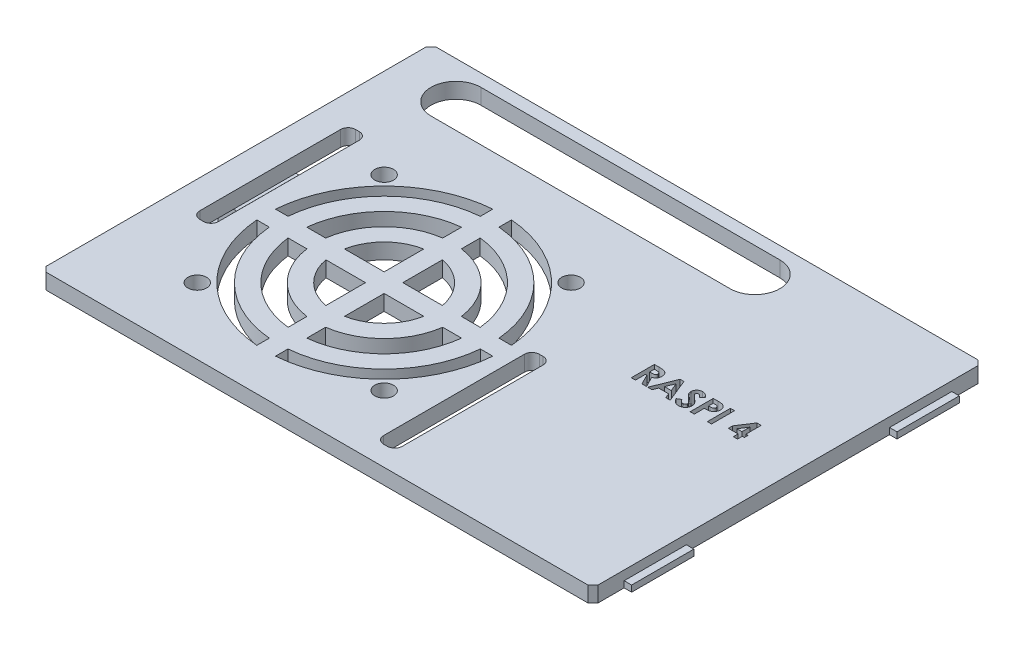
from build123d import *

# Parameters (mm, degrees)
BOSS_EXTRUDE1_DEPTH = 2.5
CUT_EXTRUDE1_DEPTH  = 2.5
SKETCH4_W           = 10
SKETCH4_H           = 1
BOSS_EXTRUDE2_DEPTH = 1.2
SKETCH6_W           = 1.5
SKETCH6_H           = 10
BOSS_EXTRUDE3_DEPTH = 5
SKETCH7_W           = 10
SKETCH7_H           = 1.2
BOSS_EXTRUDE4_DEPTH = 1.5
CHAMFER1_SIZE       = 1.5
CHAMFER2_SIZE       = 0.5
CHAMFER3_SIZE       = 0.2
CUT_EXTRUDE2_DEPTH  = 3
SKETCH10_R          = 1.5
CUT_EXTRUDE3_DEPTH  = 3
SKETCH11_W          = 0.664850428
SKETCH11_H          = 3.704166667
CUT_EXTRUDE4_DEPTH  = 2


with BuildPart() as part:
    # Sketch1 → Boss-Extrude1 (new body)
    with BuildSketch(Plane(origin=(0, 0, 0), x_dir=(1, 0, 0), z_dir=(0, 1, 0))):
        Polygon((44.69064293, 30.208190172), (43.776429368, 31.122403734), (-43.395143508, 31.122403734), (-44.30935707, 30.208190172), (-44.30935707, -30.963382704), (-43.395143508, -31.877596266), (43.776429368, -31.877596266), (44.69064293, -30.963382704), align=None)
    extrude(amount=BOSS_EXTRUDE1_DEPTH)

    # Sketch2 → Cut-Extrude1 (cut)
    with BuildSketch(Plane(origin=(0, 2.5, 0), x_dir=(1, 0, 0), z_dir=(0, 1, 0))):
        Polygon((44.69064293, -30.963382704), (44.69064293, 30.208190172), (43.776429368, 31.122403734), (-43.395143508, 31.122403734), (-44.30935707, 30.208190172), (-44.30935707, -30.963382704), (-43.395143508, -31.877596266), (43.776429368, -31.877596266), align=None)
        Polygon((43.693586655, 30.922403734), (-43.312300795, 30.922403734), (-44.10935707, 30.125347459), (-44.10935707, -30.880539991), (-43.312300795, -31.677596266), (43.693586655, -31.677596266), (44.49064293, -30.880539991), (44.49064293, 30.125347459), align=None, mode=Mode.SUBTRACT)
    extrude(amount=-CUT_EXTRUDE1_DEPTH, mode=Mode.SUBTRACT)

    # Sketch4 → Boss-Extrude2 (add)
    with BuildSketch(Plane(origin=(44.49064293, 0, 0), x_dir=(0, 0, -1), z_dir=(1, 0, 0))):
        with Locations((20.922403734, 0.5)):
            Rectangle(SKETCH4_W, SKETCH4_H)
        with Locations((-21.677596266, 0.5)):
            Rectangle(SKETCH4_W, SKETCH4_H)
    extrude(amount=BOSS_EXTRUDE2_DEPTH)

    # Sketch6 → Boss-Extrude3 (add)
    with BuildSketch(Plane.XZ):
        with Locations((-41.25935707, 0.377596266)):
            Rectangle(SKETCH6_W, SKETCH6_H)
    extrude(amount=BOSS_EXTRUDE3_DEPTH)

    # Sketch7 → Boss-Extrude4 (add)
    with BuildSketch(Plane.ZY.offset(42.00935707)):
        with Locations((0.377596266, -4.4)):
            Rectangle(SKETCH7_W, SKETCH7_H)
    extrude(amount=BOSS_EXTRUDE4_DEPTH)

    # Chamfer1
    chamfer1_edges = [part.edges().sort_by_distance(p)[0] for p in [
        (-40.50935707, 0, 0.377596266),
    ]]
    chamfer(chamfer1_edges, length=CHAMFER1_SIZE)

    # Chamfer2
    chamfer2_edges = [part.edges().sort_by_distance(p)[0] for p in [
        (-42.00935707, -3.8, 0.377596266),
    ]]
    chamfer(chamfer2_edges, length=CHAMFER2_SIZE)

    # Chamfer3
    chamfer3_edges = [part.edges().sort_by_distance(p)[0] for p in [
        (-43.50935707, -5, 0.377596266),
        (-43.50935707, -3.8, 0.377596266),
    ]]
    chamfer(chamfer3_edges, length=CHAMFER3_SIZE)

    # Sketch9 → Cut-Extrude2 (cut)
    with BuildSketch(Plane.XZ):
        with BuildLine():
            Line((7.7, 3.5), (8.3, 3.5))
            ThreePointArc((8.3, 3.5), (9.148528137, 3.851471863), (9.5, 4.7))
            Line((9.5, 4.7), (9.5, 27.3))
            ThreePointArc((9.5, 27.3), (9.148528137, 28.148528137), (8.3, 28.5))
            Line((8.3, 28.5), (7.7, 28.5))
            ThreePointArc((7.7, 28.5), (6.851471863, 28.148528137), (6.5, 27.3))
            Line((6.5, 27.3), (6.5, 4.7))
            ThreePointArc((6.5, 4.7), (6.851471863, 3.851471863), (7.7, 3.5))
        make_face()
        with BuildLine():
            Line((-38.3, 12), (-37.7, 12))
            ThreePointArc((-37.7, 12), (-36.851471863, 11.648528137), (-36.5, 10.8))
            Line((-36.5, 10.8), (-36.5, -11.8))
            ThreePointArc((-36.5, -11.8), (-36.851471863, -12.648528137), (-37.7, -13))
            Line((-37.7, -13), (-38.3, -13))
            ThreePointArc((-38.3, -13), (-39.148528137, -12.648528137), (-39.5, -11.8))
            Line((-39.5, -11.8), (-39.5, 10.8))
            ThreePointArc((-39.5, 10.8), (-39.148528137, 11.648528137), (-38.3, 12))
        make_face()
        with BuildLine():
            Line((-34.10935707, -20.922403734), (13.89064293, -20.922403734))
            ThreePointArc((13.89064293, -20.922403734), (17.89064293, -24.922403734), (13.89064293, -28.922403734))
            Line((13.89064293, -28.922403734), (-34.10935707, -28.922403734))
            ThreePointArc((-34.10935707, -28.922403734), (-38.10935707, -24.922403734), (-34.10935707, -20.922403734))
        make_face()
    extrude(amount=-CUT_EXTRUDE2_DEPTH, mode=Mode.SUBTRACT)

    # Sketch10 → Cut-Extrude3 (cut)
    with BuildSketch(Plane(origin=(0, 2.5, 0), x_dir=(1, 0, 0), z_dir=(0, 1, 0))):
        with BuildLine():
            ThreePointArc((-6.851240247, -4.5), (-9.052502821, -0.343145751), (-13.20935707, 1.858116823))
            Line((-13.20935707, 1.858116823), (-13.20935707, -4.5))
            Line((-13.20935707, -4.5), (-6.851240247, -4.5))
        make_face()
        with BuildLine():
            Line((-6.851240247, -7.5), (-13.20935707, -7.5))
            Line((-13.20935707, -7.5), (-13.20935707, -13.858116823))
            ThreePointArc((-13.20935707, -13.858116823), (-9.052502821, -11.656854249), (-6.851240247, -7.5))
        make_face()
        with BuildLine():
            Line((-16.20935707, -13.858116823), (-16.20935707, -7.5))
            Line((-16.20935707, -7.5), (-22.567473893, -7.5))
            ThreePointArc((-22.567473893, -7.5), (-20.36621132, -11.656854249), (-16.20935707, -13.858116823))
        make_face()
        with BuildLine():
            Line((-16.20935707, -4.5), (-16.20935707, 1.858116823))
            ThreePointArc((-16.20935707, 1.858116823), (-20.36621132, -0.343145751), (-22.567473893, -4.5))
            Line((-22.567473893, -4.5), (-16.20935707, -4.5))
        make_face()
        with BuildLine():
            Line((-16.20935707, 4.897247359), (-16.20935707, 7.919410907))
            ThreePointArc((-16.20935707, 7.919410907), (-24.608852007, 3.899494937), (-28.628767977, -4.5))
            Line((-28.628767977, -4.5), (-25.606604429, -4.5))
            ThreePointArc((-25.606604429, -4.5), (-22.487531663, 1.778174593), (-16.20935707, 4.897247359))
        make_face()
        with BuildLine():
            ThreePointArc((-0.789946163, -4.5), (-4.809862133, 3.899494937), (-13.20935707, 7.919410907))
            Line((-13.20935707, 7.919410907), (-13.20935707, 4.897247359))
            ThreePointArc((-13.20935707, 4.897247359), (-6.931182477, 1.778174593), (-3.812109711, -4.5))
            Line((-3.812109711, -4.5), (-0.789946163, -4.5))
        make_face()
        with BuildLine():
            ThreePointArc((-13.20935707, -19.919410907), (-4.809862133, -15.899494937), (-0.789946163, -7.5))
            Line((-0.789946163, -7.5), (-3.812109711, -7.5))
            ThreePointArc((-3.812109711, -7.5), (-6.931182477, -13.778174593), (-13.20935707, -16.897247359))
            Line((-13.20935707, -16.897247359), (-13.20935707, -19.919410907))
        make_face()
        with BuildLine():
            Line((-25.606604429, -7.5), (-28.628767977, -7.5))
            ThreePointArc((-28.628767977, -7.5), (-24.608852007, -15.899494937), (-16.20935707, -19.919410907))
            Line((-16.20935707, -19.919410907), (-16.20935707, -16.897247359))
            ThreePointArc((-16.20935707, -16.897247359), (-22.487531663, -13.778174593), (-25.606604429, -7.5))
        make_face()
        with BuildLine():
            Line((-31.643051292, -7.5), (-33.650053995, -7.5))
            ThreePointArc((-33.650053995, -7.5), (-28.144385913, -19.435028843), (-16.20935707, -24.940696925))
            Line((-16.20935707, -24.940696925), (-16.20935707, -22.933694222))
            ThreePointArc((-16.20935707, -22.933694222), (-26.73017235, -18.02081528), (-31.643051292, -7.5))
        make_face()
        with BuildLine():
            Line((-16.20935707, 10.933694222), (-16.20935707, 12.940696925))
            ThreePointArc((-16.20935707, 12.940696925), (-28.144385913, 7.435028843), (-33.650053995, -4.5))
            Line((-33.650053995, -4.5), (-31.643051292, -4.5))
            ThreePointArc((-31.643051292, -4.5), (-26.73017235, 6.02081528), (-16.20935707, 10.933694222))
        make_face()
        with BuildLine():
            ThreePointArc((4.231339855, -4.5), (-1.274328228, 7.435028843), (-13.20935707, 12.940696925))
            Line((-13.20935707, 12.940696925), (-13.20935707, 10.933694222))
            ThreePointArc((-13.20935707, 10.933694222), (-2.68854179, 6.02081528), (2.224337152, -4.5))
            Line((2.224337152, -4.5), (4.231339855, -4.5))
        make_face()
        with BuildLine():
            ThreePointArc((-13.20935707, -24.940696925), (-1.274328228, -19.435028843), (4.231339855, -7.5))
            Line((4.231339855, -7.5), (2.224337152, -7.5))
            ThreePointArc((2.224337152, -7.5), (-2.68854179, -18.02081528), (-13.20935707, -22.933694222))
            Line((-13.20935707, -22.933694222), (-13.20935707, -24.940696925))
        make_face()
        with Locations(Location((-29.70935707, -21, 0), (0, 0, 270))):
            Circle(SKETCH10_R)
        with Locations(Location((0.29064293, -21, 0), (0, 0, 270))):
            Circle(SKETCH10_R)
        with Locations(Location((-29.70935707, 9, 0), (0, 0, 270))):
            Circle(SKETCH10_R)
        with Locations(Location((0.29064293, 9, 0), (0, 0, 270))):
            Circle(SKETCH10_R)
    extrude(amount=-CUT_EXTRUDE3_DEPTH, mode=Mode.SUBTRACT)

    # Sketch11 → Cut-Extrude4 (cut)
    # profile 1 of 6: a face of its own
    with BuildSketch(Plane(origin=(0, 2.5, 0), x_dir=(1, 0, 0), z_dir=(0, 1, 0))):
        with BuildLine():
            Line((18.345718286, 4.320163812), (19.120387757, 4.320163812))
            add(Edge.make_bspline(
                [(19.120387757, 4.320163812), (19.171593173, 4.319982062), (19.270075612, 4.319632506), (19.412081911, 4.314117436), (19.542534225, 4.306442764), (19.661625701, 4.29473101), (19.76930539, 4.27920264), (19.865681213, 4.260897261), (19.950750351, 4.240034358), (20.025230246, 4.214037534), (20.092444669, 4.184713511), (20.155097855, 4.15101967), (20.214572028, 4.113331205), (20.270469666, 4.070656428), (20.323276534, 4.023763048), (20.373092254, 3.972603864), (20.419212885, 3.916745065), (20.461352845, 3.856539609), (20.499760027, 3.79320485), (20.53370392, 3.726653829), (20.561307151, 3.656840264), (20.585697564, 3.584773112), (20.603265188, 3.509422158), (20.615483214, 3.431520958), (20.624428775, 3.350795291), (20.624943102, 3.295953857), (20.625205465, 3.267978649)],
                knots=[0, 0, 0, 0, 1.749336639, 3.364467119, 4.854658419, 6.213483162, 7.451590619, 8.570285859, 9.5643256, 10.440900261, 11.26203566, 12.067320669, 12.869050712, 13.665104639, 14.467235401, 15.27997916, 16.102287765, 16.939272006, 17.78853747, 18.631303466, 19.488103222, 20.351255419, 21.228522269, 22.127379805, 23.044756219, 24, 24, 24, 24], degree=3))
            add(Edge.make_bspline(
                [(20.625205465, 3.267978649), (20.624523939, 3.238778959), (20.623187589, 3.181523688), (20.615989284, 3.097420365), (20.602833042, 3.016956188), (20.582906001, 2.940366747), (20.560002455, 2.866698796), (20.529546614, 2.797311556), (20.495174188, 2.731195889), (20.454351061, 2.669287027), (20.409549673, 2.61020985), (20.357446602, 2.556227824), (20.301417326, 2.50443962), (20.238312236, 2.458089075), (20.170913061, 2.414042132), (20.097880652, 2.374123871), (20.019691644, 2.33733084), (19.964720899, 2.316812505), (19.93661038, 2.306319995)],
                knots=[0, 0, 0, 0, 1.099860209, 2.156625411, 3.176576793, 4.16617041, 5.135385252, 6.078461593, 7.016046972, 7.938469504, 8.868247731, 9.803980173, 10.76021508, 11.73834243, 12.748633912, 13.790971185, 14.870363756, 16, 16, 16, 16], degree=3))
            Line((19.93661038, 2.306319995), (20.791418072, 0.615997145))
            Line((20.791418072, 0.615997145), (20.052365588, 0.615997145))
            Line((20.052365588, 0.615997145), (19.236142965, 2.230633898))
            Line((19.236142965, 2.230633898), (19.010568713, 2.230633898))
            Line((19.010568713, 2.230633898), (19.010568713, 0.615997145))
            Line((19.010568713, 0.615997145), (18.345718286, 0.615997145))
            Line((18.345718286, 0.615997145), (18.345718286, 4.320163812))
        make_face()
        with BuildLine():
            Line((19.010568713, 2.895484325), (19.269533891, 2.895484325))
            add(Edge.make_bspline(
                [(19.269533891, 2.895484325), (19.301194536, 2.895840908), (19.36181787, 2.896523689), (19.449002185, 2.899690709), (19.528186336, 2.907321662), (19.599710366, 2.916963087), (19.663934177, 2.928095503), (19.720284915, 2.944048932), (19.76963086, 2.961143436), (19.81138726, 2.982387469), (19.847062969, 3.006546542), (19.877866659, 3.033991849), (19.903345729, 3.065756298), (19.924316302, 3.100976668), (19.940629128, 3.139964473), (19.952536242, 3.182291717), (19.959190557, 3.228440561), (19.959956159, 3.260289547), (19.960355038, 3.276882896)],
                knots=[0, 0, 0, 0, 1.688639943, 3.233382647, 4.650958383, 5.928841754, 7.082724185, 8.122798841, 9.049171256, 9.863274652, 10.613301712, 11.341792392, 12.054588806, 12.776240173, 13.521029143, 14.301969904, 15.115324896, 16, 16, 16, 16], degree=3))
            add(Edge.make_bspline(
                [(19.960355038, 3.276882896), (19.95960092, 3.296514039), (19.958119596, 3.33507578), (19.943420259, 3.390591167), (19.92002209, 3.441974456), (19.887949608, 3.488993484), (19.847558487, 3.53021361), (19.801206488, 3.56654948), (19.747893225, 3.595281166), (19.698529155, 3.614232281), (19.653619389, 3.625570928), (19.613089743, 3.634020388), (19.566156168, 3.640008763), (19.512783233, 3.6463605), (19.453106987, 3.65047928), (19.386802159, 3.653485168), (19.314059176, 3.654715025), (19.263350408, 3.655108189), (19.236884986, 3.655313385)],
                knots=[0, 0, 0, 0, 1.020303359, 2.004196876, 2.966617323, 3.9489082, 4.950758222, 5.960522915, 7.003732012, 8.091992268, 8.70421221, 9.413913587, 10.24622431, 11.166358409, 12.212345909, 13.359657661, 14.621978493, 16, 16, 16, 16], degree=3))
            Line((19.236884986, 3.655313385), (19.010568713, 3.655313385))
            Line((19.010568713, 3.655313385), (19.010568713, 2.895484325))
        make_face(mode=Mode.SUBTRACT)
    # profile 2 of 6: a face of its own
    with BuildSketch(Plane(origin=(0, 2.5, 0), x_dir=(1, 0, 0), z_dir=(0, 1, 0))):
        Polygon((22.476546778, 4.320163812), (23.09464991, 4.320163812), (24.590563371, 0.615997145), (23.880449689, 0.615997145), (23.59254571, 1.375826205), (21.980135019, 1.375826205), (21.691489019, 0.615997145), (20.981375337, 0.615997145), align=None)
        Polygon((22.785969354, 3.326598274), (22.232422012, 2.040676633), (23.340258717, 2.040676633), align=None, mode=Mode.SUBTRACT)
    # profile 3 of 6: a face of its own
    with BuildSketch(Plane(origin=(0, 2.5, 0), x_dir=(1, 0, 0), z_dir=(0, 1, 0))):
        with BuildLine():
            Line((27.036263158, 3.825236094), (26.539109378, 3.370377487))
            add(Edge.make_bspline(
                [(26.539109378, 3.370377487), (26.517813442, 3.400417619), (26.476928214, 3.458090483), (26.410657525, 3.535315807), (26.344686082, 3.601194756), (26.278402699, 3.655452117), (26.211219867, 3.697758237), (26.143254204, 3.727711437), (26.074891027, 3.746752971), (26.028961526, 3.7491241), (26.006338612, 3.750292017)],
                knots=[0, 0, 0, 0, 1.299362458, 2.494594718, 3.587462134, 4.587049575, 5.512617175, 6.380583204, 7.202344345, 8, 8, 8, 8], degree=3))
            add(Edge.make_bspline(
                [(26.006338612, 3.750292017), (25.985236606, 3.749551971), (25.944494178, 3.748123137), (25.886412825, 3.733920633), (25.834847372, 3.709409197), (25.789848145, 3.677358432), (25.754202119, 3.63874469), (25.725741531, 3.598248804), (25.709715828, 3.553550504), (25.70760653, 3.522849908), (25.706562303, 3.507651292)],
                knots=[0, 0, 0, 0, 1.185010067, 2.2879431, 3.333075148, 4.379039566, 5.372662701, 6.27520591, 7.14612461, 8, 8, 8, 8], degree=3))
            add(Edge.make_bspline(
                [(25.706562303, 3.507651292), (25.707216667, 3.492233505), (25.708534466, 3.461184225), (25.721262612, 3.415677638), (25.740447561, 3.371212406), (25.758779563, 3.344144303), (25.76815001, 3.330308377)],
                knots=[0, 0, 0, 0, 0.967525499, 1.948461899, 2.951351359, 4, 4, 4, 4], degree=3))
            add(Edge.make_bspline(
                [(25.76815001, 3.330308377), (25.77666876, 3.319553856), (25.796277797, 3.29479837), (25.833668216, 3.255589539), (25.880622729, 3.20755529), (25.938948244, 3.152347378), (26.006223511, 3.087980312), (26.085566823, 3.016984386), (26.174694334, 2.937160938), (26.238044104, 2.881574779), (26.271239954, 2.852447132)],
                knots=[0, 0, 0, 0, 0.473873513, 1.090794244, 1.870441696, 2.795289791, 3.865433203, 5.087734844, 6.473946851, 8, 8, 8, 8], degree=3))
            add(Edge.make_bspline(
                [(26.271239954, 2.852447132), (26.302399034, 2.82548052), (26.361532494, 2.774303493), (26.445667666, 2.701665919), (26.519608469, 2.636315666), (26.584432052, 2.579233499), (26.639155754, 2.529820498), (26.684009633, 2.487840467), (26.719541502, 2.454110681), (26.739739289, 2.43373787), (26.748359178, 2.425043286)],
                knots=[0, 0, 0, 0, 1.543621617, 2.929473131, 4.163658386, 5.240097082, 6.164993805, 6.925417477, 7.541396219, 8, 8, 8, 8], degree=3))
            add(Edge.make_bspline(
                [(26.748359178, 2.425043286), (26.781061238, 2.389652653), (26.843926082, 2.321619428), (26.925628219, 2.216189325), (26.992871719, 2.113268047), (27.044892567, 2.010918963), (27.084180803, 1.907665379), (27.11187953, 1.800975007), (27.128468482, 1.689733), (27.130310243, 1.61382391), (27.13124179, 1.575429738)],
                knots=[0, 0, 0, 0, 1.206664779, 2.319633467, 3.337109185, 4.282041471, 5.190008762, 6.099243693, 7.03861361, 8, 8, 8, 8], degree=3))
            add(Edge.make_bspline(
                [(27.13124179, 1.575429738), (27.130578739, 1.538019325), (27.129277807, 1.464618703), (27.113343892, 1.357207826), (27.090623065, 1.254410955), (27.05549268, 1.157346665), (27.012675974, 1.064421676), (26.95899905, 0.977083464), (26.895962863, 0.894448129), (26.823713713, 0.81799288), (26.743797575, 0.748615041), (26.658079921, 0.68685325), (26.565722562, 0.635861025), (26.467514584, 0.593872564), (26.363508556, 0.56153249), (26.25382838, 0.537630162), (26.138306293, 0.523284361), (26.059310626, 0.521784678), (26.018952961, 0.521018513)],
                knots=[0, 0, 0, 0, 1.043214005, 2.046824704, 3.02475056, 3.976699089, 4.921714032, 5.875962561, 6.831408892, 7.817874052, 8.806269674, 9.781291748, 10.760897367, 11.74438705, 12.757449933, 13.795994037, 14.874007457, 16, 16, 16, 16], degree=3))
            add(Edge.make_bspline(
                [(26.018952961, 0.521018513), (25.987272539, 0.521580545), (25.924527133, 0.52269369), (25.83204989, 0.531781595), (25.742752659, 0.546448506), (25.656736024, 0.567470572), (25.573612465, 0.59410838), (25.493378568, 0.626645443), (25.416588215, 0.665586071), (25.342660373, 0.710129492), (25.271954423, 0.761850271), (25.203576316, 0.819690994), (25.138205248, 0.884541277), (25.075527256, 0.956247752), (25.01594337, 1.035013473), (24.957503196, 1.119741484), (24.902803992, 1.212004219), (24.86901386, 1.276727275), (24.851754611, 1.309786375)],
                knots=[0, 0, 0, 0, 1.016823716, 2.013894106, 2.979844003, 3.91962641, 4.853723003, 5.779685073, 6.695824784, 7.614987388, 8.547259901, 9.504950863, 10.487499108, 11.500346958, 12.559593716, 13.656357062, 14.802919212, 16, 16, 16, 16], degree=3))
            Line((24.851754611, 1.309786375), (25.436466817, 1.660762103))
            add(Edge.make_bspline(
                [(25.436466817, 1.660762103), (25.458055558, 1.623235705), (25.49944302, 1.551294393), (25.569577944, 1.454632122), (25.641427593, 1.371856888), (25.716653066, 1.304431747), (25.794339651, 1.25145514), (25.87486259, 1.213594381), (25.958278459, 1.190158614), (26.01509756, 1.187296566), (26.04343964, 1.18586894)],
                knots=[0, 0, 0, 0, 1.283663364, 2.460892379, 3.537111102, 4.529833553, 5.449777664, 6.316464042, 7.160231139, 8, 8, 8, 8], degree=3))
            add(Edge.make_bspline(
                [(26.04343964, 1.18586894), (26.072267593, 1.187034817), (26.128198021, 1.189296787), (26.20803155, 1.210189924), (26.281225952, 1.242993683), (26.344494652, 1.289800123), (26.398066598, 1.343821868), (26.43760577, 1.40392353), (26.462444544, 1.468952077), (26.465070605, 1.514125184), (26.466391363, 1.536844668)],
                knots=[0, 0, 0, 0, 1.13588714, 2.203786484, 3.234766741, 4.283437687, 5.291419208, 6.222934724, 7.106237994, 8, 8, 8, 8], degree=3))
            add(Edge.make_bspline(
                [(26.466391363, 1.536844668), (26.465171697, 1.557981451), (26.462694062, 1.600918802), (26.444444569, 1.664759738), (26.415915044, 1.728571641), (26.382162605, 1.78091189), (26.347815271, 1.824734961), (26.314971473, 1.862705671), (26.274976416, 1.904656657), (26.227931508, 1.950640691), (26.174458337, 2.001062583), (26.114511858, 2.055917394), (26.047405619, 2.11472192), (25.999974798, 2.154778983), (25.975173748, 2.175724376)],
                knots=[0, 0, 0, 0, 0.916159276, 1.861089862, 2.860218735, 3.940849679, 4.552606315, 5.27541173, 6.11797699, 7.06649574, 8.129236253, 9.306560635, 10.591630461, 12, 12, 12, 12], degree=3))
            add(Edge.make_bspline(
                [(25.975173748, 2.175724376), (25.928025965, 2.215615921), (25.837535098, 2.292179872), (25.709660024, 2.405262416), (25.594433131, 2.510948415), (25.492849645, 2.61054438), (25.403615233, 2.702211002), (25.327334231, 2.786692835), (25.26484462, 2.864641538), (25.199087778, 2.956966562), (25.136605632, 3.069470947), (25.082603326, 3.204826764), (25.04756891, 3.340165407), (25.04364379, 3.431024317), (25.041711876, 3.475744408)],
                knots=[0, 0, 0, 0, 1.345494975, 2.582412109, 3.71882943, 4.751509156, 5.681369928, 6.505683931, 7.230279997, 7.856715994, 8.973648664, 10.023341002, 11.027102913, 12, 12, 12, 12], degree=3))
            add(Edge.make_bspline(
                [(25.041711876, 3.475744408), (25.042515356, 3.507457496), (25.0440983, 3.569935685), (25.058218401, 3.66180076), (25.079321429, 3.750442838), (25.109969084, 3.835538513), (25.149746041, 3.916981199), (25.198053609, 3.995169593), (25.255641915, 4.069384065), (25.320540047, 4.139575418), (25.392041173, 4.203722326), (25.468449213, 4.260338401), (25.549331691, 4.30815716), (25.634193807, 4.347826294), (25.723561418, 4.378190495), (25.816776157, 4.399714155), (25.913971723, 4.412515741), (25.980082048, 4.414255968), (26.013758817, 4.415142445)],
                knots=[0, 0, 0, 0, 1.010766082, 1.991317756, 2.957454644, 3.913069143, 4.869106762, 5.843196583, 6.838735724, 7.860187025, 8.887984031, 9.89767229, 10.887916223, 11.879572884, 12.879850636, 13.892031539, 14.926195476, 16, 16, 16, 16], degree=3))
            add(Edge.make_bspline(
                [(26.013758817, 4.415142445), (26.057402243, 4.413545875), (26.144344589, 4.410365339), (26.272891354, 4.385494585), (26.39845046, 4.346382704), (26.499628341, 4.299198523), (26.580133692, 4.253491185), (26.641833524, 4.211409626), (26.704616423, 4.163202938), (26.768988696, 4.108719209), (26.833754206, 4.046931895), (26.900754545, 3.97931189), (26.969076753, 3.905274801), (27.013475356, 3.852383048), (27.036263158, 3.825236094)],
                knots=[0, 0, 0, 0, 1.282922637, 2.555718331, 3.837320111, 5.142675274, 5.830281639, 6.55870424, 7.337177975, 8.157850921, 9.037902056, 9.96903443, 10.957596896, 12, 12, 12, 12], degree=3))
        make_face()
    # profile 4 of 6: a face of its own
    with BuildSketch(Plane(origin=(0, 2.5, 0), x_dir=(1, 0, 0), z_dir=(0, 1, 0))):
        with BuildLine():
            Line((27.796092217, 4.320163812), (28.538112784, 4.320163812))
            add(Edge.make_bspline(
                [(28.538112784, 4.320163812), (28.586595445, 4.319946793), (28.680128661, 4.319528119), (28.815011254, 4.314451133), (28.93944705, 4.305352864), (29.05340746, 4.294108843), (29.156845627, 4.278345163), (29.249891087, 4.260273338), (29.332563147, 4.238256595), (29.40579406, 4.212123027), (29.471516439, 4.181312571), (29.533711006, 4.148497236), (29.590972159, 4.109333291), (29.646190039, 4.06804166), (29.696207747, 4.020677769), (29.744145685, 3.970393754), (29.787973552, 3.915195391), (29.827894429, 3.855750844), (29.864108815, 3.793158391), (29.895748126, 3.727306137), (29.921412164, 3.658089878), (29.9429411, 3.585957364), (29.960233351, 3.510911738), (29.971743624, 3.432491463), (29.97956198, 3.3512441), (29.980251842, 3.295947093), (29.980600764, 3.267978649)],
                knots=[0, 0, 0, 0, 1.698747864, 3.27724071, 4.728299578, 6.070144658, 7.288476769, 8.393259625, 9.389771311, 10.283485332, 11.113357557, 11.931608583, 12.74405601, 13.541433047, 14.344816069, 15.154114104, 15.974336324, 16.810834471, 17.661136416, 18.50621059, 19.367396281, 20.244825668, 21.142564693, 22.063065223, 23.020325768, 24, 24, 24, 24], degree=3))
            add(Edge.make_bspline(
                [(29.980600764, 3.267978649), (29.980095917, 3.237037825), (29.979103831, 3.176235304), (29.969378185, 3.087106267), (29.95276371, 3.0021298), (29.93104946, 2.920589281), (29.900770482, 2.843826233), (29.866178172, 2.770009065), (29.823618658, 2.701207384), (29.77498761, 2.636560564), (29.721876957, 2.575542997), (29.663025855, 2.519916448), (29.599556031, 2.469301714), (29.53183489, 2.423168347), (29.459608185, 2.381609411), (29.382928032, 2.344235748), (29.301270816, 2.312242686), (29.244407187, 2.295510573), (29.215577561, 2.287027461)],
                knots=[0, 0, 0, 0, 1.102006807, 2.165578795, 3.188629044, 4.184801286, 5.166646146, 6.124351954, 7.085497154, 8.042432466, 9.003981491, 9.963833307, 10.922997304, 11.89326795, 12.880200226, 13.889073926, 14.929769137, 16, 16, 16, 16], degree=3))
            add(Edge.make_bspline(
                [(29.215577561, 2.287027461), (29.19658871, 2.282303004), (29.155452745, 2.272068309), (29.087384022, 2.261677525), (29.008941965, 2.252123838), (28.919872921, 2.243913601), (28.820125538, 2.238332553), (28.709796398, 2.233974002), (28.588835502, 2.230804886), (28.504724079, 2.230692432), (28.460942645, 2.230633898)],
                knots=[0, 0, 0, 0, 0.618981996, 1.340914327, 2.176866532, 3.120127938, 4.170906482, 5.338178032, 6.614476169, 8, 8, 8, 8], degree=3))
            Line((28.460942645, 2.230633898), (28.460942645, 0.615997145))
            Line((28.460942645, 0.615997145), (27.796092217, 0.615997145))
            Line((27.796092217, 0.615997145), (27.796092217, 4.320163812))
        make_face()
        with BuildLine():
            Line((28.460942645, 2.895484325), (28.696163164, 2.895484325))
            add(Edge.make_bspline(
                [(28.696163164, 2.895484325), (28.738965251, 2.895755723), (28.817721728, 2.8962551), (28.925275263, 2.903476385), (29.011707352, 2.914504745), (29.079990308, 2.930321963), (29.133906169, 2.954326687), (29.180405224, 2.982095632), (29.22028865, 3.0172087), (29.254821827, 3.057331389), (29.282430061, 3.10343437), (29.301574934, 3.154766944), (29.314011067, 3.21025056), (29.315159659, 3.248863485), (29.315750337, 3.26872067)],
                knots=[0, 0, 0, 0, 1.8619151, 3.425951444, 4.686033666, 5.651700536, 6.461346321, 7.243864085, 7.999046032, 8.762387399, 9.539336099, 10.322741239, 11.137448474, 12, 12, 12, 12], degree=3))
            add(Edge.make_bspline(
                [(29.315750337, 3.26872067), (29.315165735, 3.286069633), (29.314031466, 3.319730794), (29.305698818, 3.368312198), (29.292418974, 3.413600089), (29.273176991, 3.455121494), (29.248301664, 3.492805862), (29.217973605, 3.526638348), (29.182581984, 3.557343502), (29.155257584, 3.573596209), (29.141375504, 3.581853349)],
                knots=[0, 0, 0, 0, 1.102301479, 2.1387299, 3.123554645, 4.094223062, 5.036071848, 5.982632524, 6.975082478, 8, 8, 8, 8], degree=3))
            add(Edge.make_bspline(
                [(29.141375504, 3.581853349), (29.129616581, 3.587800173), (29.104720531, 3.60039082), (29.062320144, 3.615028366), (29.013390746, 3.62737675), (28.957602006, 3.637625789), (28.895176484, 3.645580107), (28.826125315, 3.651663171), (28.750346886, 3.654109408), (28.697647523, 3.65490099), (28.670192444, 3.655313385)],
                knots=[0, 0, 0, 0, 0.656809284, 1.390599849, 2.23162475, 3.173112763, 4.218524733, 5.370385145, 6.63003504, 8, 8, 8, 8], degree=3))
            Line((28.670192444, 3.655313385), (28.460942645, 3.655313385))
            Line((28.460942645, 3.655313385), (28.460942645, 2.895484325))
        make_face(mode=Mode.SUBTRACT)
    # profile 5 of 6: a face of its own
    with BuildSketch(Plane(origin=(0, 2.5, 0), x_dir=(1, 0, 0), z_dir=(0, 1, 0))):
        with Locations((30.882897773, 2.468080479)):
            Rectangle(SKETCH11_W, SKETCH11_H)
    # profile 6 of 6: a face of its own
    with BuildSketch(Plane(origin=(0, 2.5, 0), x_dir=(1, 0, 0), z_dir=(0, 1, 0))):
        Polygon((34.702077627, 4.415142445), (35.394382816, 4.415142445), (35.394382816, 1.993187316), (35.726808029, 1.993187316), (35.726808029, 1.375826205), (35.394382816, 1.375826205), (35.394382816, 0.615997145), (34.729532388, 0.615997145), (34.729532388, 1.375826205), (33.162384953, 1.375826205), (33.162384953, 2.048838859), align=None)
        Polygon((34.729532388, 1.993187316), (34.729532388, 3.253880258), (33.909599663, 1.993187316), align=None, mode=Mode.SUBTRACT)
    extrude(amount=-CUT_EXTRUDE4_DEPTH, mode=Mode.SUBTRACT)


solid = part.part
